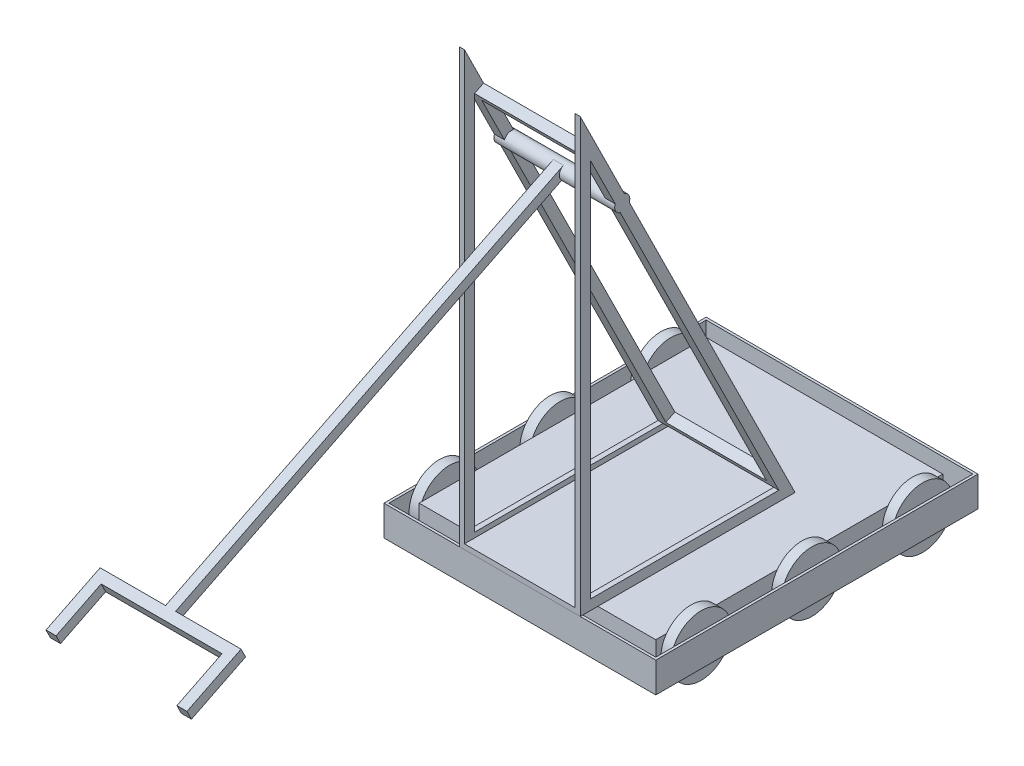
from build123d import *

# Parameters (mm, degrees)
SKETCH3_W             = 685.8
SKETCH3_H             = 812.8
SKETCH3_W_2           = 673.1
SKETCH3_H_2           = 800.1
EXTRUDE_THIN1_DEPTH   = 76.2
SKETCH5_W             = 596.9
SKETCH5_H             = 723.9
SKETCH5_W_2           = 584.2
SKETCH5_H_2           = 711.2
EXTRUDE_THIN2_DEPTH   = 76.2
BOSS_EXTRUDE2_START   = -12.7
SKETCH6_R             = 76.2
BOSS_EXTRUDE2_DEPTH   = 25.4
BOSS_EXTRUDE2_2_DEPTH = 25.4
BOSS_EXTRUDE2_3_DEPTH = 25.4
BOSS_EXTRUDE3_START   = 622.3
SKETCH6_2_R           = 76.2
BOSS_EXTRUDE3_DEPTH   = 25.4
BOSS_EXTRUDE3_2_DEPTH = 25.4
BOSS_EXTRUDE3_3_DEPTH = 25.4
SKETCH10_W            = 711.2
SKETCH10_H            = 6.35
EXTRUDE_THIN3_DEPTH   = 584.2
EXTRUDE_THIN4_DEPTH   = 152.4
SHELL2_T              = -12.7
BOSS_EXTRUDE4_DEPTH   = 279.4
SHELL3_T              = -12.7
SKETCH13_R            = 19.05
BOSS_EXTRUDE5_DEPTH   = 152.4
BOSS_EXTRUDE6_DEPTH   = 25.4


with BuildPart() as part:
    # Sketch3 → Extrude-Thin1 (new body)
    with BuildSketch(Plane(origin=(0, 0, 0), x_dir=(1, 0, 0), z_dir=(0, 1, 0))):
        Rectangle(SKETCH3_W, SKETCH3_H)
        Rectangle(SKETCH3_W_2, SKETCH3_H_2, mode=Mode.SUBTRACT)
    extrude(amount=EXTRUDE_THIN1_DEPTH)


with BuildPart() as body_2:
    # Sketch5 → Extrude-Thin2 (new body)
    with BuildSketch(Plane(origin=(0, 0, 0), x_dir=(1, 0, 0), z_dir=(0, 1, 0))):
        Rectangle(SKETCH5_W, SKETCH5_H)
        Rectangle(SKETCH5_W_2, SKETCH5_H_2, mode=Mode.SUBTRACT)
    extrude(amount=EXTRUDE_THIN2_DEPTH)

    # Sketch10 → Extrude-Thin3 (add)
    with BuildSketch(Plane(origin=(-292.1, 0, 0), x_dir=(0, 0, -1), z_dir=(1, 0, 0))):
        with Locations((0, 73.025)):
            Rectangle(SKETCH10_W, SKETCH10_H)
    extrude(amount=EXTRUDE_THIN3_DEPTH)


with BuildPart() as body_3:
    # Sketch6 → Boss-Extrude2 (new body)
    with BuildSketch(Plane(origin=(-292.1, 0, 0), x_dir=(0, 0, -1), z_dir=(1, 0, 0)).offset(BOSS_EXTRUDE2_START)):
        with Locations((0, 38.1)):
            Circle(SKETCH6_R)
    extrude(amount=-BOSS_EXTRUDE2_DEPTH)


with BuildPart() as body_4:
    # Sketch6 → Boss-Extrude2 2 (new body)
    with BuildSketch(Plane(origin=(-292.1, 0, 0), x_dir=(0, 0, -1), z_dir=(1, 0, 0)).offset(BOSS_EXTRUDE2_START)):
        with Locations((-279.4, 38.1)):
            Circle(SKETCH6_R)
    extrude(amount=-BOSS_EXTRUDE2_2_DEPTH)


with BuildPart() as body_5:
    # Sketch6 → Boss-Extrude2 3 (new body)
    with BuildSketch(Plane(origin=(-292.1, 0, 0), x_dir=(0, 0, -1), z_dir=(1, 0, 0)).offset(BOSS_EXTRUDE2_START)):
        with Locations((279.4, 38.1)):
            Circle(SKETCH6_R)
    extrude(amount=-BOSS_EXTRUDE2_3_DEPTH)


with BuildPart() as body_6:
    # Sketch6<2> → Boss-Extrude3 (new body)
    with BuildSketch(Plane(origin=(-292.1, 0, 0), x_dir=(0, 0, -1), z_dir=(1, 0, 0)).offset(BOSS_EXTRUDE3_START)):
        with Locations((0, 38.1)):
            Circle(SKETCH6_2_R)
    extrude(amount=-BOSS_EXTRUDE3_DEPTH)


with BuildPart() as body_7:
    # Sketch6<2> → Boss-Extrude3 2 (new body)
    with BuildSketch(Plane(origin=(-292.1, 0, 0), x_dir=(0, 0, -1), z_dir=(1, 0, 0)).offset(BOSS_EXTRUDE3_START)):
        with Locations((-279.4, 38.1)):
            Circle(SKETCH6_2_R)
    extrude(amount=-BOSS_EXTRUDE3_2_DEPTH)


with BuildPart() as body_8:
    # Sketch6<2> → Boss-Extrude3 3 (new body)
    with BuildSketch(Plane(origin=(-292.1, 0, 0), x_dir=(0, 0, -1), z_dir=(1, 0, 0)).offset(BOSS_EXTRUDE3_START)):
        with Locations((279.4, 38.1)):
            Circle(SKETCH6_2_R)
    extrude(amount=-BOSS_EXTRUDE3_3_DEPTH)


with BuildPart() as body_9:
    # Sketch11 → Extrude-Thin4 (new, symmetric)
    with BuildSketch(Plane(origin=(0, 0, 0), x_dir=(0, 0, -1), z_dir=(1, 0, 0))):
        Polygon((-406.4, 76.2), (-406.4, 1168.4), (135.400516796, 76.2), align=None)
        Polygon((-381, 101.6), (-381, 1060.039896641), (94.447016405, 101.6), align=None, mode=Mode.SUBTRACT)
    extrude(amount=EXTRUDE_THIN4_DEPTH, both=True)

    # Shell2
    shell2_openings = [body_9.faces().sort_by_distance(p)[0] for p in [
        (0, 101.6, 143.276491797),
        (0, 580.81994832, 143.276491797),
        (0, 580.81994832, 381),
        (0, 622.3, 406.4),
        (0, 622.3, 135.499741602),
    ]]
    offset(amount=SHELL2_T, openings=shell2_openings, kind=Kind.INTERSECTION)



with BuildPart() as body_10:
    # Sketch12 → Boss-Extrude4 (new body)
    with BuildSketch(Plane(origin=(-139.7, 0, 0), x_dir=(0, 0, -1), z_dir=(1, 0, 0))):
        Polygon((-381, 1060.039896641), (94.447016405, 101.6), (117.201183072, 112.887510767), (-358.245833333, 1071.327407407), align=None)
    extrude(amount=BOSS_EXTRUDE4_DEPTH)

    # Shell3
    shell3_openings = [body_10.faces().sort_by_distance(p)[0] for p in [
        (0, 592.107459087, 120.522325131),
        (0, 580.81994832, 143.276491797),
    ]]
    offset(amount=SHELL3_T, openings=shell3_openings, kind=Kind.INTERSECTION)


with BuildPart() as body_9_1:
    add(body_9.part)

    add(body_10.part)  # Boss-Extrude5 merges body 10
    # Sketch13 → Boss-Extrude5 (add, symmetric)
    with BuildSketch(Plane(origin=(0, 0, 0), x_dir=(0, 0, -1), z_dir=(1, 0, 0))):
        with Locations(Location((-300.526287858, 926.393755383, 0), (0, 0, 158.194644645))):
            Circle(SKETCH13_R)
    extrude(amount=BOSS_EXTRUDE5_DEPTH, both=True)

    # Sketch14 → Boss-Extrude6 (add)
    with BuildSketch(Plane(origin=(0, 880.15207481, 436.611288217), x_dir=(1, 0, 0), z_dir=(0, 0.8958333333333334, 0.4443901876604491))):
        Polygon((-12.7, 142.458828596), (12.7, 142.458828596), (12.7, -949.741171404), (177.8, -949.741171404), (177.8, -1102.141171404), (152.4, -1102.141171404), (152.4, -975.141171404), (-152.4, -975.141171404), (-152.4, -1102.141171404), (-177.8, -1102.141171404), (-177.8, -949.741171404), (-12.7, -949.741171404), align=None)
    extrude(amount=-BOSS_EXTRUDE6_DEPTH)


solid = Compound([part.part, body_2.part, body_3.part, body_4.part, body_5.part, body_6.part, body_7.part, body_8.part, body_9_1.part])
